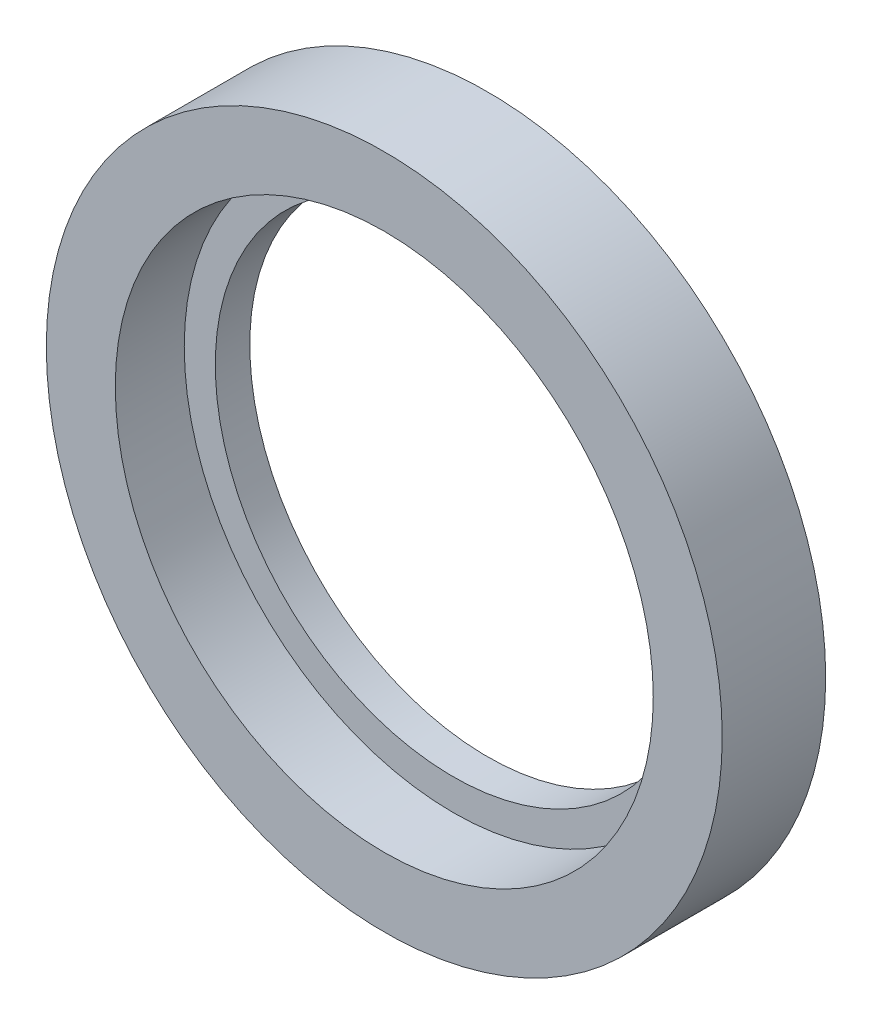
from build123d import *

# Parameters (mm, degrees)
SZKIC1_R                    = 49
SZKIC1_R_2                  = 34.5
DODANIE_WYCI_GNI_CIE1_DEPTH = 15
SZKIC2_R                    = 3.3
WYTNIJ_WYCI_GNI_CIE1_DEPTH  = 6
SZYK_KO_OWY1_COUNT          = 6
SZKIC3_R                    = 39
WYTNIJ_WYCI_GNI_CIE2_DEPTH  = 10


with BuildPart() as part:
    # Szkic1 → Dodanie-wyciągnięcie1 (new body)
    with BuildSketch(Plane.XY):
        Circle(SZKIC1_R)
        Circle(SZKIC1_R_2, mode=Mode.SUBTRACT)
    extrude(amount=DODANIE_WYCI_GNI_CIE1_DEPTH)

    # Szkic2 → Wytnij-wyciągnięcie1 (cut)
    with BuildSketch(Plane(origin=(0, 0, 0), x_dir=(-1, 0, 0), z_dir=(0, 0, -1))):
        with Locations((44, 0)):
            Circle(SZKIC2_R)
    wytnij_wyci_gni_cie1 = extrude(amount=-WYTNIJ_WYCI_GNI_CIE1_DEPTH, mode=Mode.SUBTRACT)

    # Szyk kołowy1: Wytnij-wyciągnięcie1 ×6 about axis
    szyk_ko_owy1_axis = Axis((0, 0, 0), (0, 0, 1))
    for i in range(1, SZYK_KO_OWY1_COUNT):
        add(wytnij_wyci_gni_cie1.rotate(szyk_ko_owy1_axis, i * 360 / SZYK_KO_OWY1_COUNT), mode=Mode.SUBTRACT)

    # Szkic3 → Wytnij-wyciągnięcie2 (cut)
    with BuildSketch(Plane.XY.offset(15)):
        Circle(SZKIC3_R)
    extrude(amount=-WYTNIJ_WYCI_GNI_CIE2_DEPTH, mode=Mode.SUBTRACT)


solid = part.part
